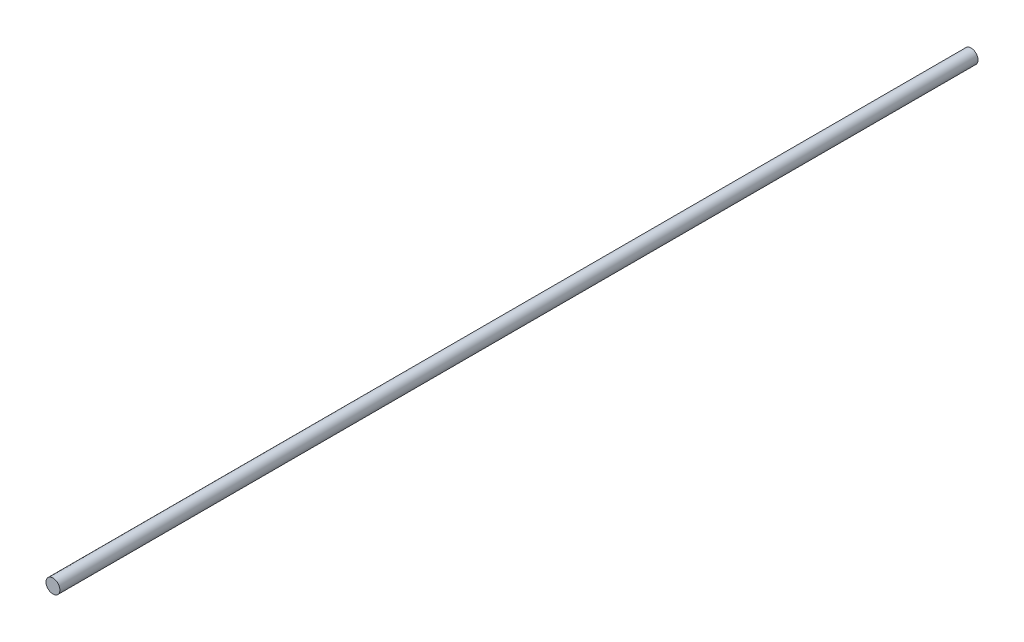
from build123d import *

# Parameters (mm, degrees)
ESQUISSE1_R        = 5
BOSS_EXTRU_1_DEPTH = 660


with BuildPart() as part:
    # Esquisse1 → Boss.-Extru.1 (new body)
    with BuildSketch(Plane.XY):
        Circle(ESQUISSE1_R)
    extrude(amount=BOSS_EXTRU_1_DEPTH)


solid = part.part
